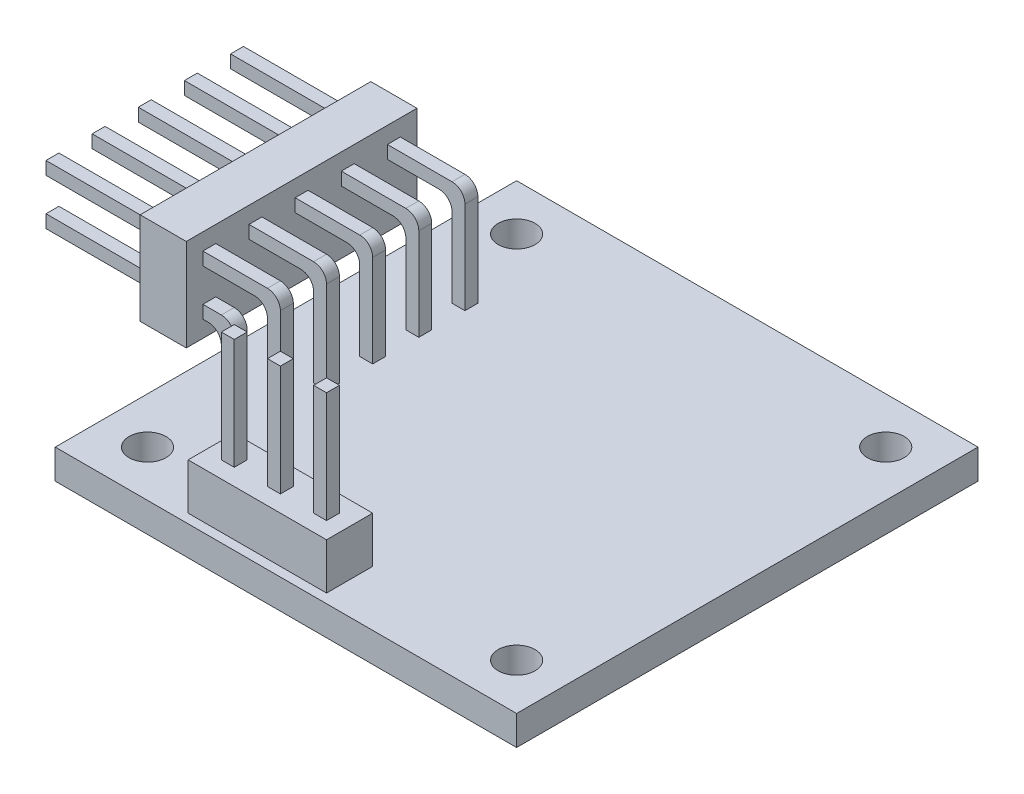
from build123d import *

# Parameters (mm, degrees)
SKETCH1_W                = 25
SKETCH1_H                = 25
SKETCH1_R                = 1
BOSS_EXTRUDE1_DEPTH      = 1.6
BOSS_EXTRUDE2_START      = -7.5
BOSS_EXTRUDE2_DEPTH      = 0.7
LPATTERN1_COUNT          = 5
LPATTERN1_PITCH          = 2.5
BOSS_EXTRUDE3_DEPTH      = 0.9
BOSS_EXTRUDE3_DEPTH_BACK = 11.6
SKETCH4_W                = 2.5
SKETCH4_H                = 5
SKETCH5_W                = 2.5
SKETCH5_H                = 2.5
BOSS_EXTRUDE4_DEPTH      = 2.5
SKETCH6_W                = 0.7
SKETCH6_H                = 0.7
BOSS_EXTRUDE5_DEPTH      = 6
LPATTERN2_COUNT          = 3
LPATTERN2_PITCH          = 2.5


with BuildPart() as part:
    # Sketch1 → Boss-Extrude1 (new body)
    with BuildSketch(Plane(origin=(0, 0, 0), x_dir=(1, 0, 0), z_dir=(0, 1, 0))):
        with Locations((12.5, 12.5)):
            Rectangle(SKETCH1_W, SKETCH1_H)
        with Locations(Location((2.5, 22.5, 0), (0, 0, 270))):
            Circle(SKETCH1_R, mode=Mode.SUBTRACT)
        with Locations(Location((22.5, 22.5, 0), (0, 0, 270))):
            Circle(SKETCH1_R, mode=Mode.SUBTRACT)
        with Locations(Location((22.5, 2.5, 0), (0, 0, 270))):
            Circle(SKETCH1_R, mode=Mode.SUBTRACT)
        with Locations(Location((2.5, 2.5, 0), (0, 0, 270))):
            Circle(SKETCH1_R, mode=Mode.SUBTRACT)
    extrude(amount=BOSS_EXTRUDE1_DEPTH)

    # Sketch3 → Boss-Extrude2 (add)
    with BuildSketch(Plane.XY.offset(BOSS_EXTRUDE2_START)):
        with BuildLine():
            Line((1.5, 1.6), (1.5, 3.4))
            ThreePointArc((1.5, 3.4), (1.294974747, 3.894974747), (0.8, 4.1))
            Line((0.8, 4.1), (-8, 4.1))
            Line((-8, 4.1), (-8, 4.8))
            Line((-8, 4.8), (1.5, 4.8))
            ThreePointArc((1.5, 4.8), (1.994974747, 4.594974747), (2.2, 4.1))
            Line((2.2, 4.1), (2.2, 1.6))
            Line((2.2, 1.6), (1.5, 1.6))
        make_face()
        with BuildLine():
            Line((4, 1.6), (4.7, 1.6))
            Line((4.7, 1.6), (4.7, 6.6))
            ThreePointArc((4.7, 6.6), (4.494974747, 7.094974747), (4, 7.3))
            Line((4, 7.3), (-8, 7.3))
            Line((-8, 7.3), (-8, 6.6))
            Line((-8, 6.6), (3.3, 6.6))
            ThreePointArc((3.3, 6.6), (3.794974747, 6.394974747), (4, 5.9))
            Line((4, 5.9), (4, 1.6))
        make_face()
    boss_extrude2 = extrude(amount=-BOSS_EXTRUDE2_DEPTH)

    # LPattern1: Boss-Extrude2 ×5
    with Locations(*[(0, 0, -i * LPATTERN1_PITCH) for i in range(1, LPATTERN1_COUNT)]):
        add(boss_extrude2)

    # Sketch4 → Boss-Extrude3 (add, two sides: drawn at the far end of the back side and taken through both)
    with BuildSketch(Plane.XY.offset(-7.5).offset(-BOSS_EXTRUDE3_DEPTH_BACK)):
        with Locations((-0.75, 5.7)):
            Rectangle(SKETCH4_W, SKETCH4_H)
    extrude(amount=BOSS_EXTRUDE3_DEPTH + BOSS_EXTRUDE3_DEPTH_BACK)

    # Sketch5 → Boss-Extrude4 (add)
    with BuildSketch(Plane(origin=(0, 1.6, 0), x_dir=(1, 0, 0), z_dir=(0, 1, 0))):
        with Locations((7.95, 1.75)):
            Rectangle(SKETCH5_W, SKETCH5_H)
    boss_extrude4 = extrude(amount=BOSS_EXTRUDE4_DEPTH)

    # Sketch6 → Boss-Extrude5 (add)
    with BuildSketch(Plane(origin=(0, 4.1, 0), x_dir=(1, 0, 0), z_dir=(0, 1, 0))):
        with Locations((7.95, 1.75)):
            Rectangle(SKETCH6_W, SKETCH6_H)
    boss_extrude5 = extrude(amount=BOSS_EXTRUDE5_DEPTH)

    # LPattern2: Boss-Extrude4, Boss-Extrude5 ×3
    with Locations(*[(i * LPATTERN2_PITCH, 0, 0) for i in range(1, LPATTERN2_COUNT)]):
        add(boss_extrude4)
        add(boss_extrude5)


solid = part.part
